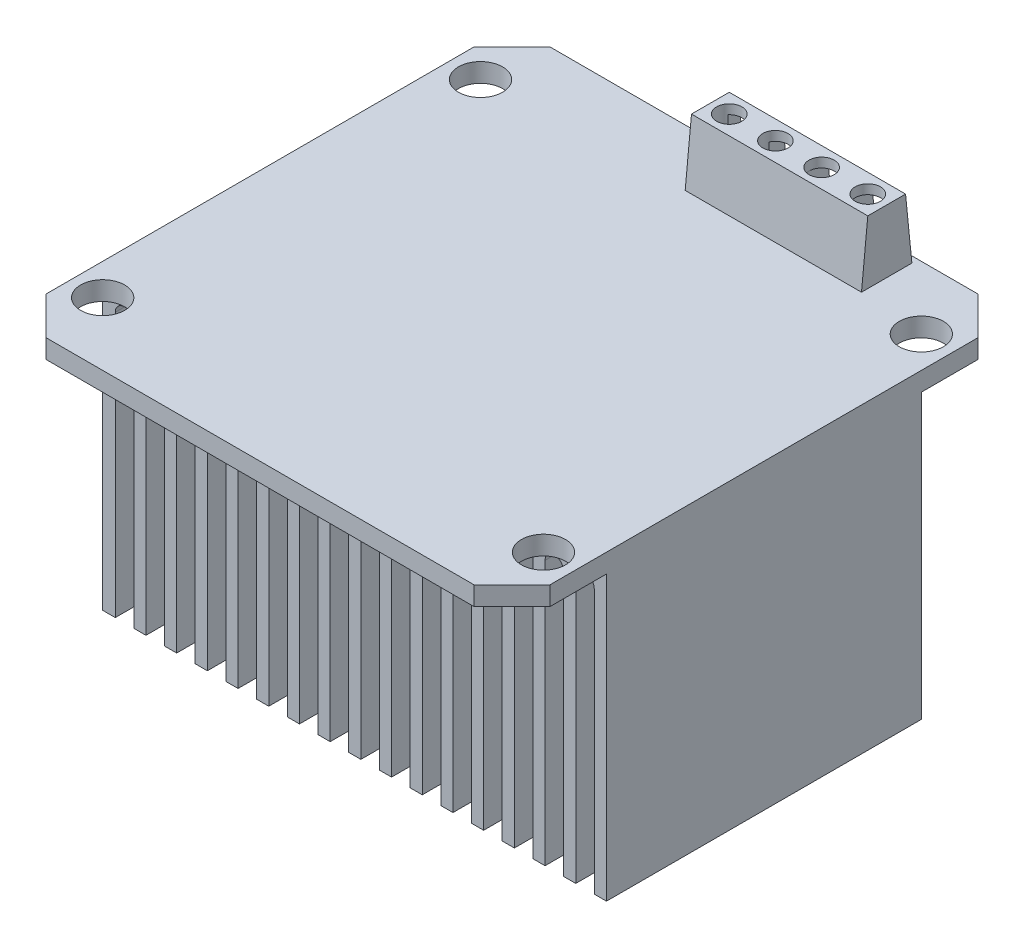
from build123d import *

# Parameters (mm, degrees)
SKETCH1_R           = 2.2225
BOSS_EXTRUDE1_DEPTH = 1.905
SKETCH2_W           = 1.228725
SKETCH2_H           = 31.75
SKETCH2_W_2         = 1.27
BOSS_EXTRUDE2_DEPTH = 28.575
BOSS_EXTRUDE4_DEPTH = 31.75
SKETCH4_W           = 17.78
SKETCH4_H           = 5.08
BOSS_EXTRUDE5_DEPTH = 6.35
CUT_EXTRUDE1_DEPTH  = 19.05
SKETCH6_R           = 1.27
CUT_EXTRUDE2_DEPTH  = 3.175
SKETCH7_W           = 2.54
SKETCH7_H           = 4.445
CUT_EXTRUDE3_DEPTH  = 4.445


with BuildPart() as part:
    # Sketch1 → Boss-Extrude1 (new body)
    with BuildSketch(Plane(origin=(0, 0, 0), x_dir=(1, 0, 0), z_dir=(0, 1, 0))):
        Polygon((21.59, 25.4), (-21.59, 25.4), (-25.4, 21.59), (-25.4, -21.59), (-21.59, -25.4), (21.59, -25.4), (25.4, -21.59), (25.4, 21.59), align=None)
        with Locations((-22.225, -19.05)):
            Circle(SKETCH1_R, mode=Mode.SUBTRACT)
        with Locations((22.225, -19.05)):
            Circle(SKETCH1_R, mode=Mode.SUBTRACT)
        with Locations((-22.225, 19.05)):
            Circle(SKETCH1_R, mode=Mode.SUBTRACT)
        with Locations((22.225, 19.05)):
            Circle(SKETCH1_R, mode=Mode.SUBTRACT)
    extrude(amount=BOSS_EXTRUDE1_DEPTH)

    # Sketch2 → Boss-Extrude2 (add)
    with BuildSketch(Plane.XZ):
        with Locations((24.7856375, 0)):
            Rectangle(SKETCH2_W, SKETCH2_H)
        with Locations((21.6900125, 0)):
            Rectangle(SKETCH2_W, SKETCH2_H)
        with Locations((18.5943875, 0)):
            Rectangle(SKETCH2_W, SKETCH2_H)
        with Locations((15.4987625, 0)):
            Rectangle(SKETCH2_W, SKETCH2_H)
        with Locations((12.4031375, 0)):
            Rectangle(SKETCH2_W, SKETCH2_H)
        with Locations((9.3075125, 0)):
            Rectangle(SKETCH2_W, SKETCH2_H)
        with Locations((6.2118875, 0)):
            Rectangle(SKETCH2_W, SKETCH2_H)
        with Locations((3.1162625, 0)):
            Rectangle(SKETCH2_W, SKETCH2_H)
        with Locations((0.0206375, 0)):
            Rectangle(SKETCH2_W, SKETCH2_H)
        with Locations((-3.0749875, 0)):
            Rectangle(SKETCH2_W, SKETCH2_H)
        with Locations((-6.1706125, 0)):
            Rectangle(SKETCH2_W, SKETCH2_H)
        with Locations((-9.2662375, 0)):
            Rectangle(SKETCH2_W, SKETCH2_H)
        with Locations((-12.3618625, 0)):
            Rectangle(SKETCH2_W, SKETCH2_H)
        with Locations((-15.4574875, 0)):
            Rectangle(SKETCH2_W, SKETCH2_H)
        with Locations((-18.5531125, 0)):
            Rectangle(SKETCH2_W, SKETCH2_H)
        with Locations((-21.6487375, 0)):
            Rectangle(SKETCH2_W, SKETCH2_H)
        with Locations((-24.765, 0)):
            Rectangle(SKETCH2_W_2, SKETCH2_H)
    extrude(amount=BOSS_EXTRUDE2_DEPTH)

    # Sketch3 → Boss-Extrude4 (add)
    with BuildSketch(Plane.XY.offset(15.875)):
        with BuildLine():
            Line((-24.13, 0), (-24.13, -1.905))
            ThreePointArc((-24.13, -1.905), (-23.19655, -0.97155), (-22.2631, -1.905))
            Line((-22.2631, -1.905), (-21.034375, -1.905))
            ThreePointArc((-21.034375, -1.905), (-20.100925, -0.97155), (-19.167475, -1.905))
            Line((-19.167475, -1.905), (-17.93875, -1.905))
            ThreePointArc((-17.93875, -1.905), (-17.0053, -0.97155), (-16.07185, -1.905))
            Line((-16.07185, -1.905), (-14.843125, -1.905))
            ThreePointArc((-14.843125, -1.905), (-13.909675, -0.97155), (-12.976225, -1.905))
            Line((-12.976225, -1.905), (-11.7475, -1.905))
            ThreePointArc((-11.7475, -1.905), (-10.81405, -0.97155), (-9.8806, -1.905))
            Line((-9.8806, -1.905), (-8.651875, -1.905))
            ThreePointArc((-8.651875, -1.905), (-7.718425, -0.97155), (-6.784975, -1.905))
            Line((-6.784975, -1.905), (-5.55625, -1.905))
            ThreePointArc((-5.55625, -1.905), (-4.6228, -0.97155), (-3.68935, -1.905))
            Line((-3.68935, -1.905), (-2.460625, -1.905))
            ThreePointArc((-2.460625, -1.905), (-1.527175, -0.97155), (-0.593725, -1.905))
            Line((-0.593725, -1.905), (0.635, -1.905))
            ThreePointArc((0.635, -1.905), (1.56845, -0.97155), (2.5019, -1.905))
            Line((2.5019, -1.905), (3.730625, -1.905))
            ThreePointArc((3.730625, -1.905), (4.664075, -0.97155), (5.597525, -1.905))
            Line((5.597525, -1.905), (6.82625, -1.905))
            ThreePointArc((6.82625, -1.905), (7.7597, -0.97155), (8.69315, -1.905))
            Line((8.69315, -1.905), (9.921875, -1.905))
            ThreePointArc((9.921875, -1.905), (10.855325, -0.97155), (11.788775, -1.905))
            Line((11.788775, -1.905), (13.0175, -1.905))
            ThreePointArc((13.0175, -1.905), (13.95095, -0.97155), (14.8844, -1.905))
            Line((14.8844, -1.905), (16.113125, -1.905))
            ThreePointArc((16.113125, -1.905), (17.046575, -0.97155), (17.980025, -1.905))
            Line((17.980025, -1.905), (19.20875, -1.905))
            ThreePointArc((19.20875, -1.905), (20.1422, -0.97155), (21.07565, -1.905))
            Line((21.07565, -1.905), (22.304375, -1.905))
            ThreePointArc((22.304375, -1.905), (23.237825, -0.97155), (24.171275, -1.905))
            Line((24.171275, -1.905), (24.171275, 0))
            Line((24.171275, 0), (-24.13, 0))
        make_face()
    extrude(amount=-BOSS_EXTRUDE4_DEPTH)

    # Sketch4 → Boss-Extrude5 (add)
    with BuildSketch(Plane(origin=(0, 1.905, 0), x_dir=(1, 0, 0), z_dir=(0, 1, 0))):
        with Locations((6.6675, 22.225)):
            Rectangle(SKETCH4_W, SKETCH4_H)
    extrude(amount=BOSS_EXTRUDE5_DEPTH)

    # Sketch5 → Cut-Extrude1 (cut)
    with BuildSketch(Plane(origin=(15.5575, 0, 0), x_dir=(0, 0, -1), z_dir=(1, 0, 0))):
        Polygon((19.685, 8.255), (19.685, 1.905), (20.32, 8.255), align=None)
        Polygon((24.765, 8.255), (24.13, 8.255), (24.765, 1.905), align=None)
    extrude(amount=-CUT_EXTRUDE1_DEPTH, mode=Mode.SUBTRACT)

    # Sketch6 → Cut-Extrude2 (cut)
    with BuildSketch(Plane(origin=(0, 8.255, 0), x_dir=(1, 0, 0), z_dir=(0, 1, 0))):
        with Locations((-0.3175, 22.225)):
            Circle(SKETCH6_R)
        with Locations((4.339166667, 22.225)):
            Circle(SKETCH6_R)
        with Locations((8.995833333, 22.225)):
            Circle(SKETCH6_R)
        with Locations((13.6525, 22.225)):
            Circle(SKETCH6_R)
    extrude(amount=-CUT_EXTRUDE2_DEPTH, mode=Mode.SUBTRACT)

    # Sketch7 → Cut-Extrude3 (cut)
    with BuildSketch(Plane(origin=(0, 0, -25.4), x_dir=(-1, 0, 0), z_dir=(0, 0, -1))):
        with Locations((-13.335, 5.08)):
            Rectangle(SKETCH7_W, SKETCH7_H)
        with Locations((-8.89, 5.08)):
            Rectangle(SKETCH7_W, SKETCH7_H)
        with Locations((-4.445, 5.08)):
            Rectangle(SKETCH7_W, SKETCH7_H)
        with Locations((0, 5.08)):
            Rectangle(SKETCH7_W, SKETCH7_H)
    extrude(amount=-CUT_EXTRUDE3_DEPTH, mode=Mode.SUBTRACT)


solid = part.part
